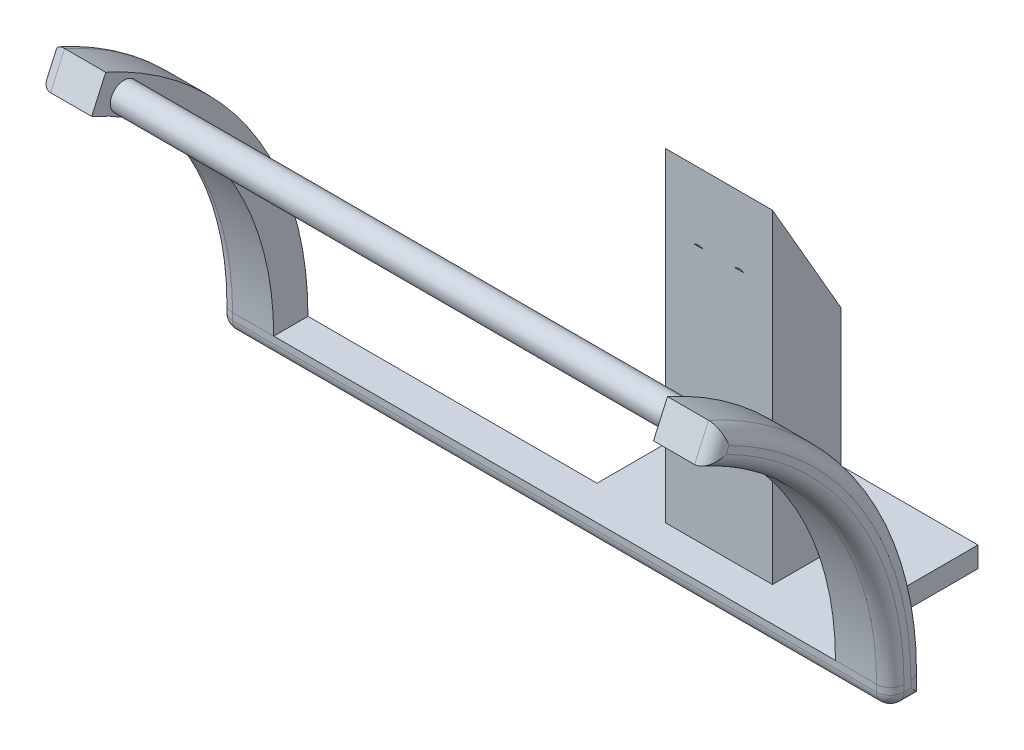
from build123d import *

# Parameters (mm, degrees)
SKETCH1_W           = 17.805
SKETCH1_H           = 20
SKETCH1_W_2         = 38
SKETCH1_H_2         = 5
BOSS_EXTRUDE1_DEPTH = 3
SKETCH3_R           = 1.5
CUT_EXTRUDE1_DEPTH  = 5
SKETCH7_W           = 15.61
SKETCH7_H           = 10
BOSS_EXTRUDE4_DEPTH = 30
BOSS_EXTRUDE5_DEPTH = 15.61
SKETCH9_R           = 1.5
CUT_EXTRUDE2_DEPTH  = 5
BOSS_EXTRUDE6_DEPTH = 8
FILLET4_R           = 2
SKETCH10_R          = 2
BOSS_EXTRUDE7_DEPTH = 82


with BuildPart() as part:
    # Sketch1 → Boss-Extrude1 (new body)
    with BuildSketch(Plane(origin=(0, 0, 0), x_dir=(1, 0, 0), z_dir=(0, 1, 0))):
        Polygon((9.368218391, 0.25), (-8.436781609, 0.25), (-26.241781609, 0.25), (-38.436781609, 0.25), (-38.436781609, -4.75), (21.563218391, -4.75), (21.563218391, 0.25), align=None)
        with Locations((0.465718391, 10.25)):
            Rectangle(SKETCH1_W, SKETCH1_H)
        with Locations((-17.339281609, 10.25)):
            Rectangle(SKETCH1_W, SKETCH1_H)
        with Locations((-57.436781609, -2.25)):
            Rectangle(SKETCH1_W_2, SKETCH1_H_2)
    extrude(amount=BOSS_EXTRUDE1_DEPTH)

    # Sketch3 → Cut-Extrude1 (cut)
    with BuildSketch(Plane.XZ):
        with Locations(Location((-20.484687418, -8.75, 0), (0, 0, 270))):
            Circle(SKETCH3_R)
        with Locations(Location((-8.434877213, -16.25, 0), (0, 0, 270))):
            Circle(SKETCH3_R)
        with Locations(Location((3.614932992, -8.75, 0), (0, 0, 270))):
            Circle(SKETCH3_R)
    extrude(amount=-CUT_EXTRUDE1_DEPTH, mode=Mode.SUBTRACT)

    # Sketch7 → Boss-Extrude4 (add)
    with BuildSketch(Plane(origin=(0, 3, 0), x_dir=(1, 0, 0), z_dir=(0, 1, 0))):
        with Locations((-8.436781609, 5.25)):
            Rectangle(SKETCH7_W, SKETCH7_H)
    extrude(amount=BOSS_EXTRUDE4_DEPTH)

    # Sketch8 → Boss-Extrude5 (add)
    with BuildSketch(Plane.ZY.offset(16.241781609)):
        Polygon((-10.25, 33), (-0.25, 50.320508076), (-0.25, 33), align=None)
    extrude(amount=-BOSS_EXTRUDE5_DEPTH)

    # Sketch9 → Cut-Extrude2 (cut)
    with BuildSketch(Plane(origin=(0, 12.688380194, -21.976919162), x_dir=(1, 0, 0), z_dir=(0, 0.4999999999999978, -0.8660254037844399))):
        with Locations(Location((-11.436781609, -33.453838325, 0), (0, 0, 270))):
            Circle(SKETCH9_R)
        with Locations(Location((-5.436781609, -33.453838325, 0), (0, 0, 270))):
            Circle(SKETCH9_R)
    extrude(amount=-CUT_EXTRUDE2_DEPTH, mode=Mode.SUBTRACT)

    # Sketch2 → Boss-Extrude6 (add)
    with BuildSketch(Plane(origin=(21.563218391, 0, 0), x_dir=(0, 0, -1), z_dir=(1, 0, 0))):
        with BuildLine():
            Line((-29.267799241, 48.612273042), (-31.316019317, 44.051045738))
            ThreePointArc((-31.316019317, 44.051045738), (-11.97084483, 27.448628481), (-4.75, 3))
            Line((-4.75, 3), (0.25, 3))
            ThreePointArc((0.25, 3), (-7.773160922, 30.165142757), (-29.267799241, 48.612273042))
        make_face()
    boss_extrude6 = extrude(amount=-BOSS_EXTRUDE6_DEPTH)

    # Mirror1: Boss-Extrude6 across plane
    add(boss_extrude6.mirror(Plane.ZY.offset(27.436781609)))

    # Fillet4
    fillet4_edges = [part.edges().sort_by_distance(p)[0] for p in [
        (-76.436781609, 27.448628481, 11.97084483),
        (-76.436781609, 30.165142757, 7.773160922),
        (-76.436781609, 46.33165939, 30.291909279),
        (21.563218391, 0, 2.25),
        (21.563218391, 1.5, 4.75),
        (21.563218391, 1.5, -0.25),
        (-76.436781609, 1.5, -0.25),
        (-76.436781609, 1.5, 4.75),
        (-76.436781609, 0, 2.25),
        (21.563218391, 27.448628481, 11.97084483),
        (-27.436781609, 0, 4.75),
        (21.563218391, 30.165142757, 7.773160922),
        (21.563218391, 46.33165939, 30.291909279),
    ]]
    fillet(fillet4_edges, radius=FILLET4_R)

    # Sketch10 → Boss-Extrude7 (add)
    with BuildSketch(Plane(origin=(-68.436781609, 0, 0), x_dir=(0, 0, -1), z_dir=(1, 0, 0))):
        with Locations(Location((-26.603637459, 44.285402207, 0), (0, 0, 180))):
            Circle(SKETCH10_R)
    extrude(amount=BOSS_EXTRUDE7_DEPTH)


solid = part.part
